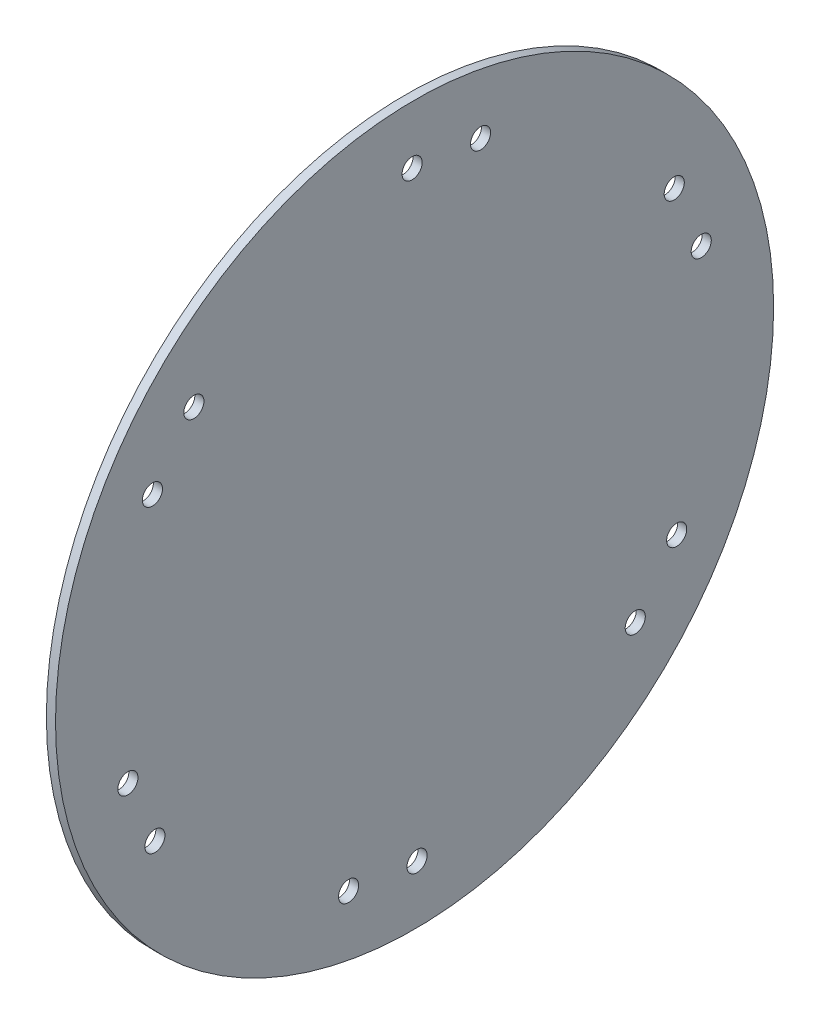
from build123d import *

# Parameters (mm, degrees)
SKETCH2_R           = 125
BOSS_EXTRUDE1_DEPTH = 3.18
SKETCH3_R           = 3.5
CUT_EXTRUDE1_DEPTH  = 177.80529517


with BuildPart() as part:
    # Sketch2 → Boss-Extrude1 (new body)
    with BuildSketch(Plane(origin=(0, 0, 0), x_dir=(0, 0, -1), z_dir=(1, 0, 0))):
        with Locations(Location((0, 0, 0), (0, 0, 180))):
            Circle(SKETCH2_R)
    extrude(amount=BOSS_EXTRUDE1_DEPTH)

    # Sketch3 → Cut-Extrude1 (cut, through all)
    with BuildSketch(Plane.ZY):
        with Locations((22.972095913, -101.972267071)):
            Circle(SKETCH3_R)
        with Locations((-0.852298011, -104.870241211)):
            Circle(SKETCH3_R)
        with Locations((-91.246441995, -51.697008876)):
            Circle(SKETCH3_R)
        with Locations((-76.824525808, -70.880552175)):
            Circle(SKETCH3_R)
        with Locations((-99.796621722, 31.091714896)):
            Circle(SKETCH3_R)
        with Locations((-90.394143984, 53.173232335)):
            Circle(SKETCH3_R)
        with Locations((0.852298011, 104.870241211)):
            Circle(SKETCH3_R)
        with Locations((-22.972095913, 101.972267071)):
            Circle(SKETCH3_R)
        with Locations((76.824525808, 70.880552175)):
            Circle(SKETCH3_R)
        with Locations((91.246441995, 51.697008876)):
            Circle(SKETCH3_R)
        with Locations((99.796621722, -31.091714896)):
            Circle(SKETCH3_R)
        with Locations((90.394143984, -53.173232335)):
            Circle(SKETCH3_R)
    extrude(amount=-CUT_EXTRUDE1_DEPTH, mode=Mode.SUBTRACT)


solid = part.part
